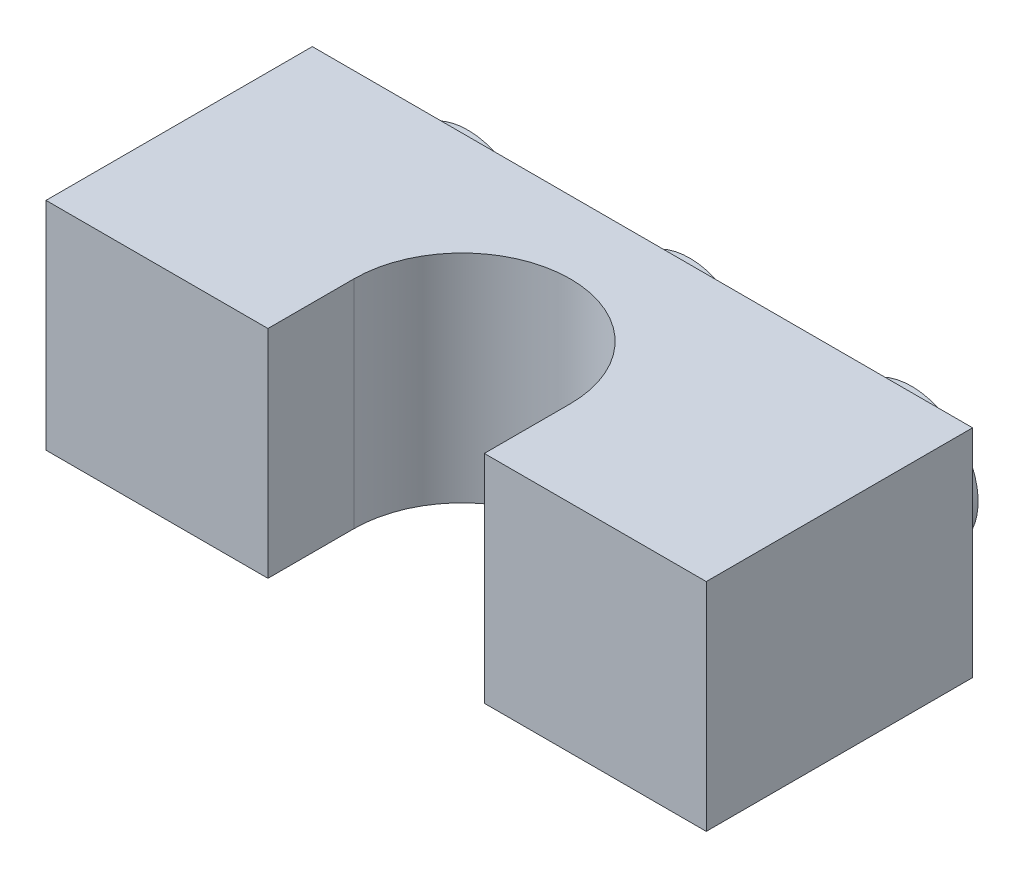
from build123d import *

# Parameters (mm, degrees)
SKETCH_1_W          = 23.8
SKETCH_1_H          = 7.8
EXTRUDE_1_DEPTH     = 9.6
SKETCH_2_R          = 2.4
EXTRUDE_2_DEPTH     = 1.7
CUT_EXTRUDE_1_DEPTH = 18.164206944


with BuildPart() as part:
    # Эскиз1 → Бобышка-Вытянуть1 (new body)
    with BuildSketch(Plane.XY):
        Rectangle(SKETCH_1_W, SKETCH_1_H)
    extrude(amount=EXTRUDE_1_DEPTH)

    # Эскиз2 → Бобышка-Вытянуть2 (add)
    with BuildSketch(Plane(origin=(0, 0, 0), x_dir=(-1, 0, 0), z_dir=(0, 0, -1))):
        Circle(SKETCH_2_R)
        with Locations((8, 0)):
            Circle(SKETCH_2_R)
        with Locations((-8, 0)):
            Circle(SKETCH_2_R)
    extrude(amount=EXTRUDE_2_DEPTH)

    # Эскиз3 → Вырез-Вытянуть1 (cut, through all)
    with BuildSketch(Plane(origin=(0, 3.9, 0), x_dir=(1, 0, 0), z_dir=(0, 1, 0))):
        with BuildLine():
            Line((-3.9, -16.6), (3.9, -16.6))
            Line((3.9, -16.6), (3.9, -6.5))
            ThreePointArc((3.9, -6.5), (0, -2.6), (-3.9, -6.5))
            Line((-3.9, -6.5), (-3.9, -16.6))
        make_face()
    extrude(amount=-CUT_EXTRUDE_1_DEPTH, mode=Mode.SUBTRACT)


solid = part.part
